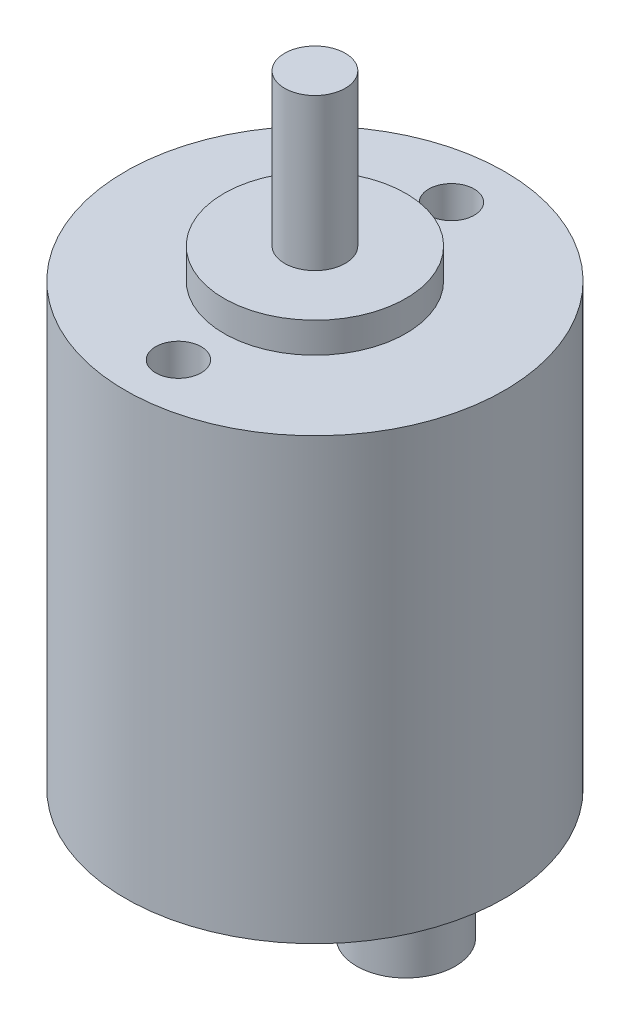
from build123d import *

# Parameters (mm, degrees)
SKETCH_1_R          = 12.5
EXTRUDE_3_DEPTH     = 29
SKETCH_4_R          = 6
EXTRUDE_4_DEPTH     = 2
SKETCH_5_R          = 2
EXTRUDE_5_DEPTH     = 10
SKETCH_6_R          = 1.5
CUT_EXTRUDE_1_DEPTH = 19
SKETCH_7_R          = 3.25
EXTRUDE_6_DEPTH     = 5.5


with BuildPart() as part:
    # 草图1 → 凸台-拉伸3 (new body)
    with BuildSketch(Plane(origin=(0, 0, 0), x_dir=(0, 0, -1), z_dir=(0, 1, 0))):
        Circle(SKETCH_1_R)
    extrude(amount=EXTRUDE_3_DEPTH)

    # 草图4 → 凸台-拉伸4 (add)
    with BuildSketch(Plane(origin=(0, 29, 0), x_dir=(0, 0, -1), z_dir=(0, 1, 0))):
        with Locations(Location((0, 0, 0), (0, 0, 90))):
            Circle(SKETCH_4_R)
    extrude(amount=EXTRUDE_4_DEPTH)

    # 草图5 → 凸台-拉伸5 (add)
    with BuildSketch(Plane(origin=(0, 31, 0), x_dir=(0, 0, -1), z_dir=(0, 1, 0))):
        with Locations(Location((0, 0, 0), (0, 0, 90))):
            Circle(SKETCH_5_R)
    extrude(amount=EXTRUDE_5_DEPTH)

    # 草图6 → 切除-拉伸1 (cut)
    with BuildSketch(Plane(origin=(0, 41, 0), x_dir=(0, 0, -1), z_dir=(0, 1, 0))):
        with Locations(Location((-9, 0, 0), (0, 0, 90))):
            Circle(SKETCH_6_R)
        with Locations(Location((9, 0, 0), (0, 0, 90))):
            Circle(SKETCH_6_R)
    extrude(amount=-CUT_EXTRUDE_1_DEPTH, mode=Mode.SUBTRACT)

    # 草图7 → 凸台-拉伸6 (add)
    with BuildSketch(Plane(origin=(0, 0, 0), x_dir=(0, 0, 1), z_dir=(0, -1, 0))):
        with Locations((0, -6)):
            Circle(SKETCH_7_R)
    extrude(amount=EXTRUDE_6_DEPTH)


solid = part.part
